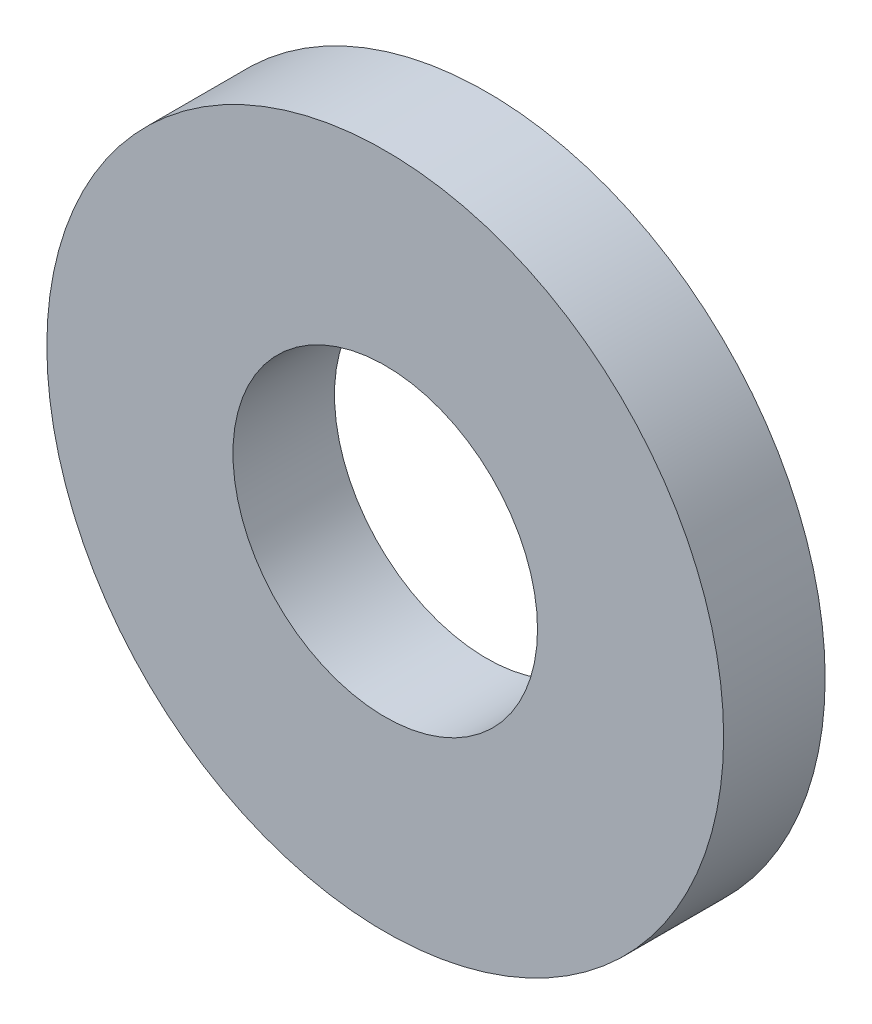
from build123d import *

# Parameters (mm, degrees)
SKETCH1_R           = 10
SKETCH1_R_2         = 4.5
BOSS_EXTRUDE1_DEPTH = 3


with BuildPart() as part:
    # Sketch1 → Boss-Extrude1 (new body)
    with BuildSketch(Plane.XY):
        Circle(SKETCH1_R)
        Circle(SKETCH1_R_2, mode=Mode.SUBTRACT)
    extrude(amount=BOSS_EXTRUDE1_DEPTH)


solid = part.part
